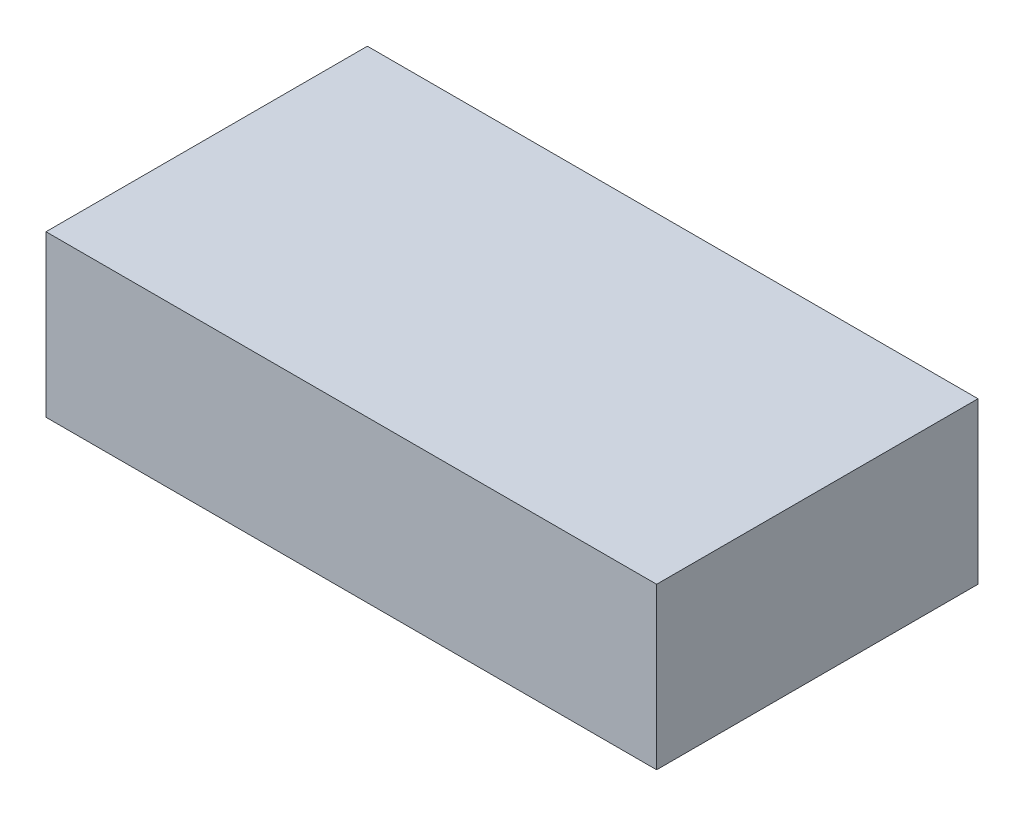
from build123d import *

# Parameters (mm, degrees)
SKETCH2_W     = 57
SKETCH2_H     = 30
BATTERY_DEPTH = 15


with BuildPart() as part:
    # Sketch2 → Battery (new body)
    with BuildSketch(Plane(origin=(0, 0, 0), x_dir=(1, 0, 0), z_dir=(0, 1, 0))):
        Rectangle(SKETCH2_W, SKETCH2_H)
    extrude(amount=BATTERY_DEPTH)


solid = part.part
